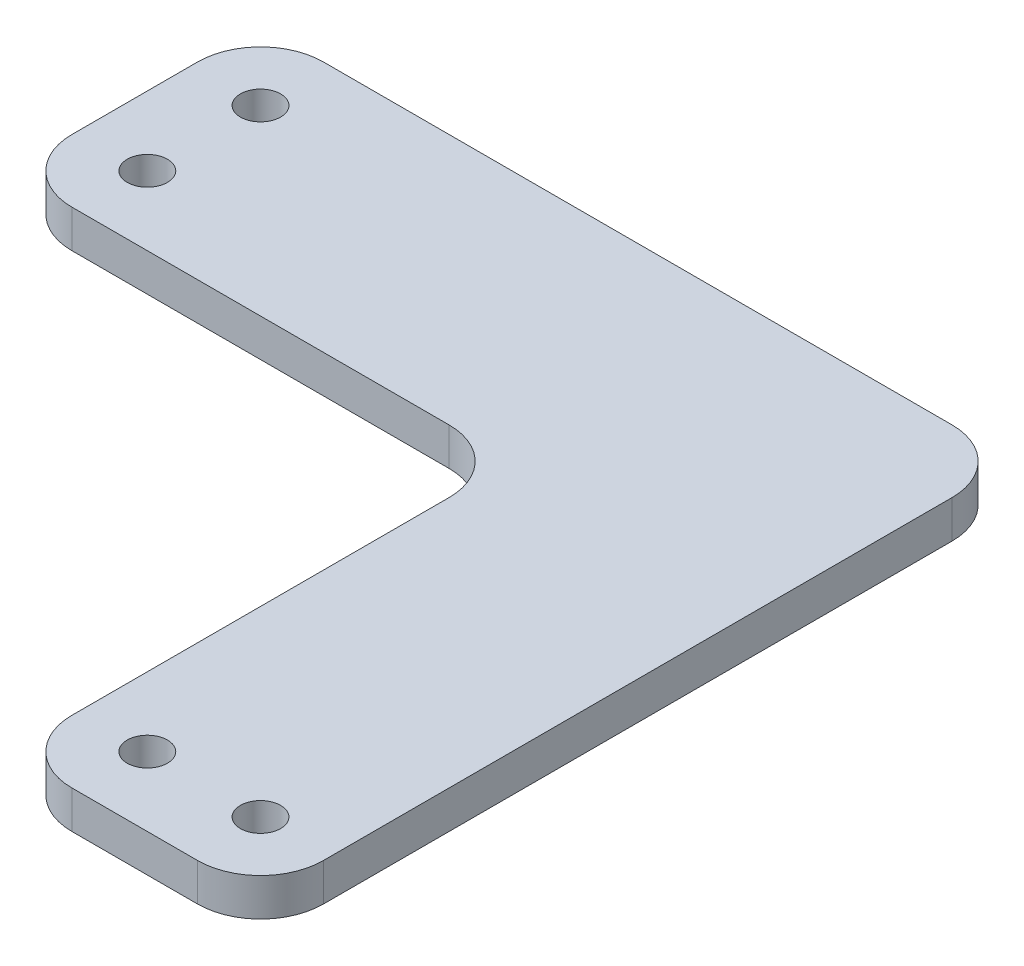
from build123d import *

# Parameters (mm, degrees)
EXTRUDE_1_DEPTH     = 3
SKETCH_2_R          = 1.6
CUT_EXTRUDE_1_DEPTH = 65.101482042
FILLET_1_R          = 5


with BuildPart() as part:
    # 草图1 → 凸台-拉伸1 (new body)
    with BuildSketch(Plane(origin=(0, 0, 0), x_dir=(1, 0, 0), z_dir=(0, 1, 0))):
        Polygon((-50, 40), (-50, 20), (-10, 20), (-10, -20), (10, -20), (10, 40), align=None)
    extrude(amount=EXTRUDE_1_DEPTH)

    # 草图2 → 切除-拉伸1 (cut, through all)
    with BuildSketch(Plane(origin=(0, 3, 0), x_dir=(1, 0, 0), z_dir=(0, 1, 0))):
        with Locations(Location((-44.5, 34.5, 0), (0, 0, 270))):
            Circle(SKETCH_2_R)
        with Locations(Location((-44.5, 25.5, 0), (0, 0, 270))):
            Circle(SKETCH_2_R)
        with Locations(Location((-4.5, -14.5, 0), (0, 0, 270))):
            Circle(SKETCH_2_R)
        with Locations(Location((4.5, -14.5, 0), (0, 0, 270))):
            Circle(SKETCH_2_R)
    extrude(amount=-CUT_EXTRUDE_1_DEPTH, mode=Mode.SUBTRACT)

    # 圆角1
    fillet_1_edges = [part.edges().sort_by_distance(p)[0] for p in [
        (10, 1.5, 20),
        (-10, 1.5, 20),
        (-10, 1.5, -20),
        (-50, 1.5, -20),
        (-50, 1.5, -40),
        (10, 1.5, -40),
    ]]
    fillet(fillet_1_edges, radius=FILLET_1_R)


solid = part.part
